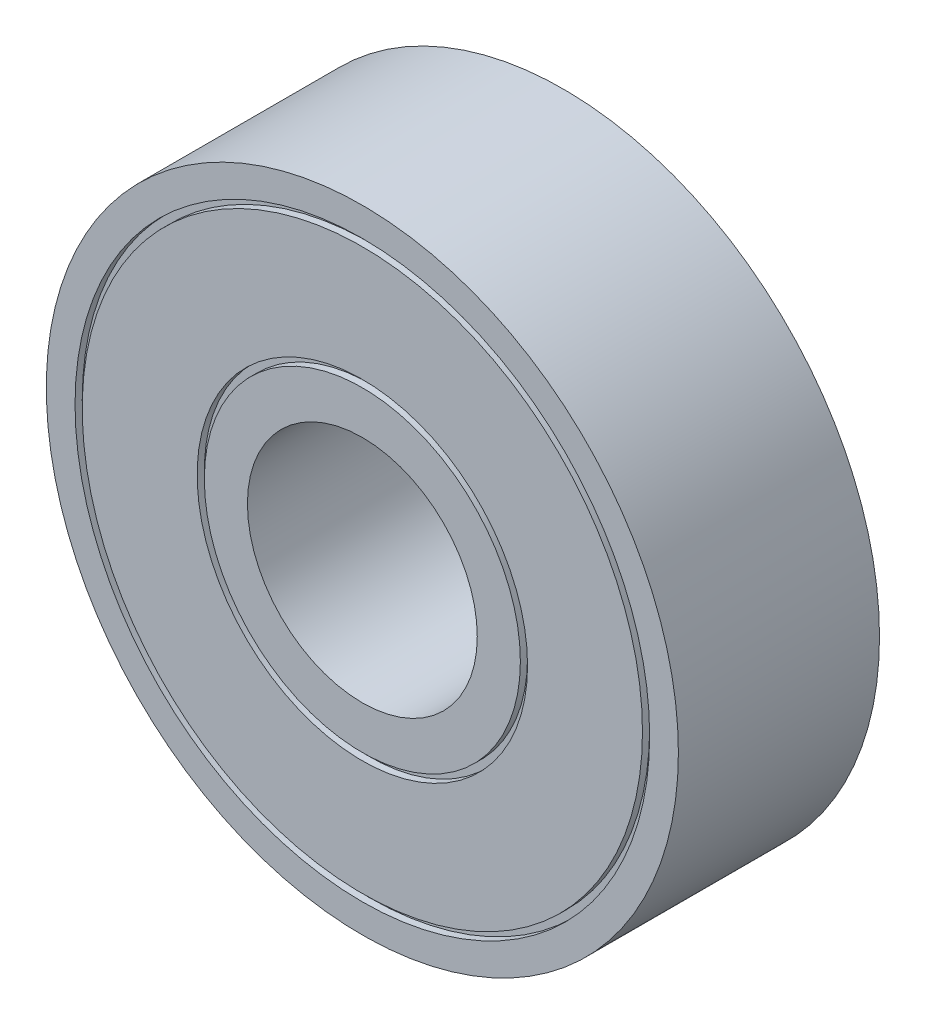
from build123d import *

# Parameters (mm, degrees)
ESBO_O1_R                = 11
ESBO_O1_R_2              = 4
RESSALTO_EXTRUS_O1_DEPTH = 3.5
ESBO_O2_R                = 10
ESBO_O2_R_2              = 9.75
ESBO_O2_R_3              = 5.75
ESBO_O2_R_4              = 5.5
CORTE_EXTRUS_O1_DEPTH    = 0.25


with BuildPart() as part:
    # Esboço1 → Ressalto-extrusão1 (new, symmetric)
    with BuildSketch(Plane.XY):
        Circle(ESBO_O1_R)
        Circle(ESBO_O1_R_2, mode=Mode.SUBTRACT)
    extrude(amount=RESSALTO_EXTRUS_O1_DEPTH, both=True)

    # Esboço2 → Corte-extrusão1 (cut)
    # profile 1 of 2: a face of its own
    with BuildSketch(Plane.XY.offset(3.5)):
        Circle(ESBO_O2_R)
        Circle(ESBO_O2_R_2, mode=Mode.SUBTRACT)
    # profile 2 of 2: a face of its own
    with BuildSketch(Plane.XY.offset(3.5)):
        Circle(ESBO_O2_R_3)
        Circle(ESBO_O2_R_4, mode=Mode.SUBTRACT)
    corte_extrus_o1 = extrude(amount=-CORTE_EXTRUS_O1_DEPTH, mode=Mode.SUBTRACT)

    # Espelhar1: Corte-extrusão1 across plane
    add(corte_extrus_o1.mirror(Plane.XY), mode=Mode.SUBTRACT)


solid = part.part
